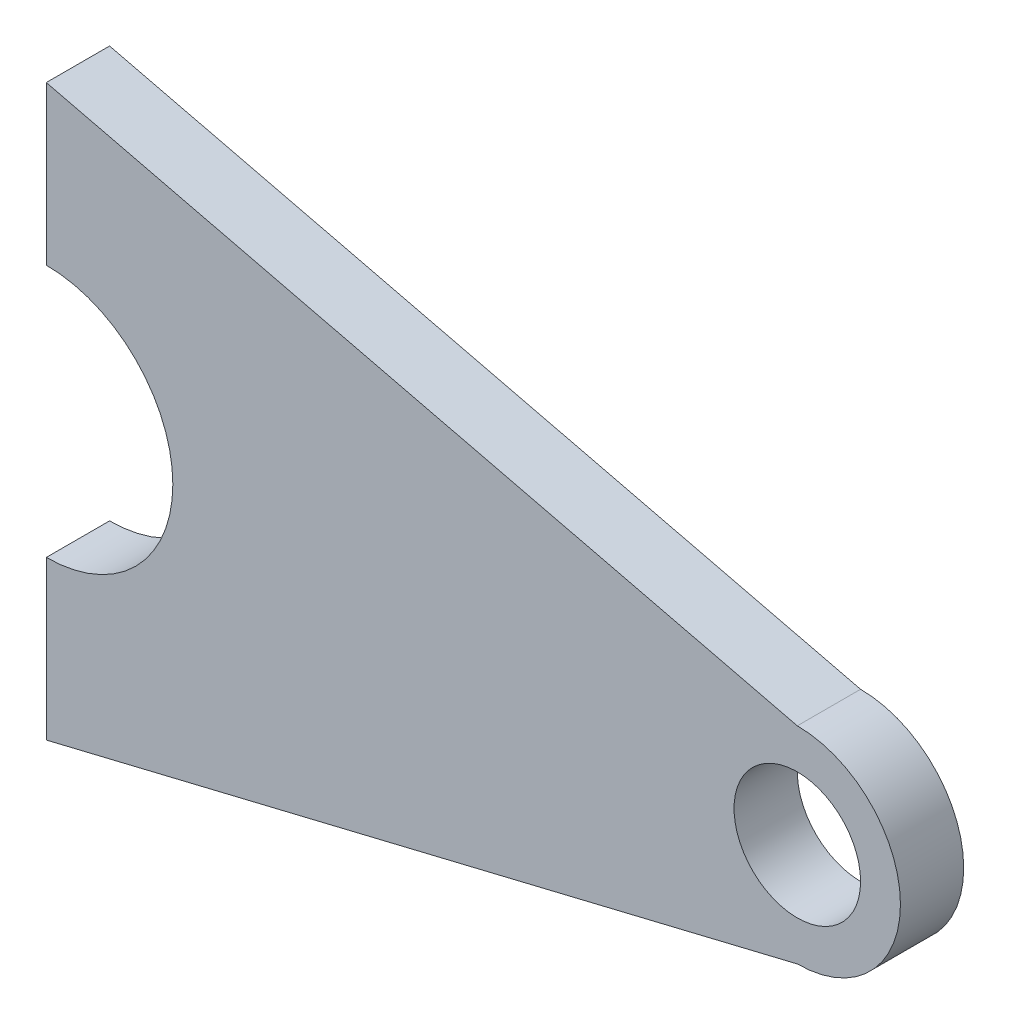
from build123d import *

# Parameters (mm, degrees)
SKETCH1_R           = 6.35
BOSS_EXTRUDE1_DEPTH = 6.35


with BuildPart() as part:
    # Sketch1 → Boss-Extrude1 (new body)
    with BuildSketch(Plane.XY):
        with BuildLine():
            Line((-75.375, 28.575), (0, 10.35))
            ThreePointArc((0, 10.35), (10.35, 0), (0, -10.35))
            Line((0, -10.35), (-75.375, -28.575))
            Line((-75.375, -28.575), (-75.375, -12.7))
            ThreePointArc((-75.375, -12.7), (-62.675, 0), (-75.375, 12.7))
            Line((-75.375, 12.7), (-75.375, 28.575))
        make_face()
        Circle(SKETCH1_R, mode=Mode.SUBTRACT)
    extrude(amount=BOSS_EXTRUDE1_DEPTH)


solid = part.part
